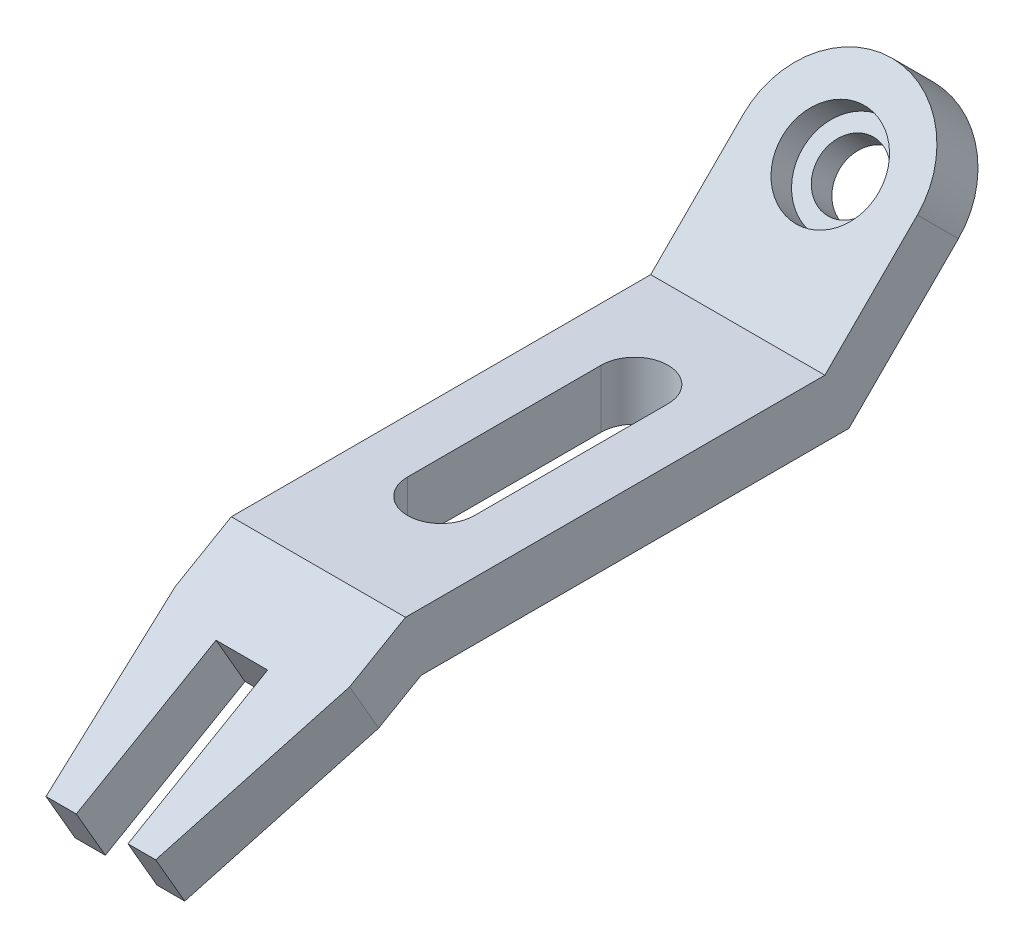
from build123d import *
from build123d.topology import SkipClean

# Parameters (mm, degrees)
BOSS_EXTRUDE1_DEPTH = 54
BOSS_EXTRUDE2_DEPTH = 18
SKETCH4_R           = 27
SKETCH4_R_2         = 15
BOSS_EXTRUDE4_DEPTH = 18
CUT_EXTRUDE1_DEPTH  = 18
BOSS_EXTRUDE5_DEPTH = 18
SKETCH4_6_R         = 15
SKETCH4_6_R_2       = 10
CUT_EXTRUDE2_DEPTH  = 9
CUT_EXTRUDE3_DEPTH  = 151.410913499


with BuildPart() as part:
    # Sketch1 → Boss-Extrude1 (new body)
    with BuildSketch(Plane(origin=(0, 0, 0), x_dir=(0, 0, -1), z_dir=(1, 0, 0))):
        Polygon((-59.11151811, 0), (73.521240549, 0), (107.462366046, 33.941125497), (94.734443984, 46.669047558), (66.065396426, 18), (-63.934603574, 18), (-81.25511165, 8), (-72.25511165, -7.588457268), align=None)
    extrude(amount=-BOSS_EXTRUDE1_DEPTH)

    # Sketch2 → Boss-Extrude2 (add)
    with BuildSketch(Plane(origin=(0, 41.184495438, 23.777879528), x_dir=(1, 0, 0), z_dir=(0, 0.8660254037844378, 0.5000000000000016))):
        Polygon((-11.626654027, -122.368990876), (0, -66.368990876), (-54, -66.368990876), (-45.626654027, -122.368990876), (-36.230586406, -122.368990876), (-36.230586406, -72.368990876), (-20.230586406, -72.368990876), (-20.230586406, -122.368990876), align=None)
    extrude(amount=-BOSS_EXTRUDE2_DEPTH)

    # Sketch4 → Boss-Extrude4 (add)
    with BuildSketch(Plane(origin=(0, -24.032698213, -24.032698213), x_dir=(1, 0, 0), z_dir=(0, 0.7071067811865462, 0.7071067811865489))):
        with Locations((-27, 99.987367753)):
            Circle(SKETCH4_R)
        with Locations((-27, 99.987367753)):
            Circle(SKETCH4_R_2, mode=Mode.SUBTRACT)
    extrude(amount=-BOSS_EXTRUDE4_DEPTH)

    # Sketch4<4> → Cut-Extrude1 (cut)
    with BuildSketch(Plane(origin=(0, -24.032698213, -24.032698213), x_dir=(1, 0, 0), z_dir=(0, 0.7071067811865462, 0.7071067811865489))):
        with BuildLine():
            ThreePointArc((-37, 99.987367753), (-27, 89.987367753), (-17, 99.987367753))
            Line((-17, 99.987367753), (-37, 99.987367753))
        make_face()
    extrude(amount=-CUT_EXTRUDE1_DEPTH, mode=Mode.SUBTRACT)

    # Sketch4<5> → Boss-Extrude5 (add)
    with SkipClean():  # the faces are left unmerged after this step: merging them gives an invalid solid
        with BuildSketch(Plane(origin=(0, -24.032698213, -24.032698213), x_dir=(1, 0, 0), z_dir=(0, 0.7071067811865462, 0.7071067811865489))):
            with BuildLine():
                Line((-17, 99.987367753), (-12, 99.987367753))
                ThreePointArc((-12, 99.987367753), (-27, 114.987367753), (-42, 99.987367753))
                Line((-42, 99.987367753), (-37, 99.987367753))
                ThreePointArc((-37, 99.987367753), (-27, 109.987367753), (-17, 99.987367753))
            make_face()
        extrude(amount=-BOSS_EXTRUDE5_DEPTH)

    # Sketch4<6> → Cut-Extrude2 (cut)
    with SkipClean():  # the faces are left unmerged after this step: merging them gives an invalid solid
        with BuildSketch(Plane(origin=(0, -24.032698213, -24.032698213), x_dir=(1, 0, 0), z_dir=(0, 0.7071067811865462, 0.7071067811865489))):
            with Locations((-27, 99.987367753)):
                Circle(SKETCH4_6_R)
            with Locations((-27, 99.987367753)):
                Circle(SKETCH4_6_R_2, mode=Mode.SUBTRACT)
        extrude(amount=-CUT_EXTRUDE2_DEPTH, mode=Mode.SUBTRACT)

    # Sketch5 → Cut-Extrude3 (cut, through all)
    with SkipClean():  # the faces are left unmerged after this step: merging them gives an invalid solid
        with BuildSketch(Plane(origin=(0, 18, 0), x_dir=(1, 0, 0), z_dir=(0, 1, 0))):
            with BuildLine():
                Line((-37.365679465, 34.065396426), (-37.365679465, -25.934603574))
                ThreePointArc((-37.365679465, -25.934603574), (-27, -36.300283039), (-16.634320535, -25.934603574))
                Line((-16.634320535, -25.934603574), (-16.634320535, 34.065396426))
                ThreePointArc((-16.634320535, 34.065396426), (-27, 44.431075891), (-37.365679465, 34.065396426))
            make_face()
        extrude(amount=-CUT_EXTRUDE3_DEPTH, mode=Mode.SUBTRACT)


solid = part.part
